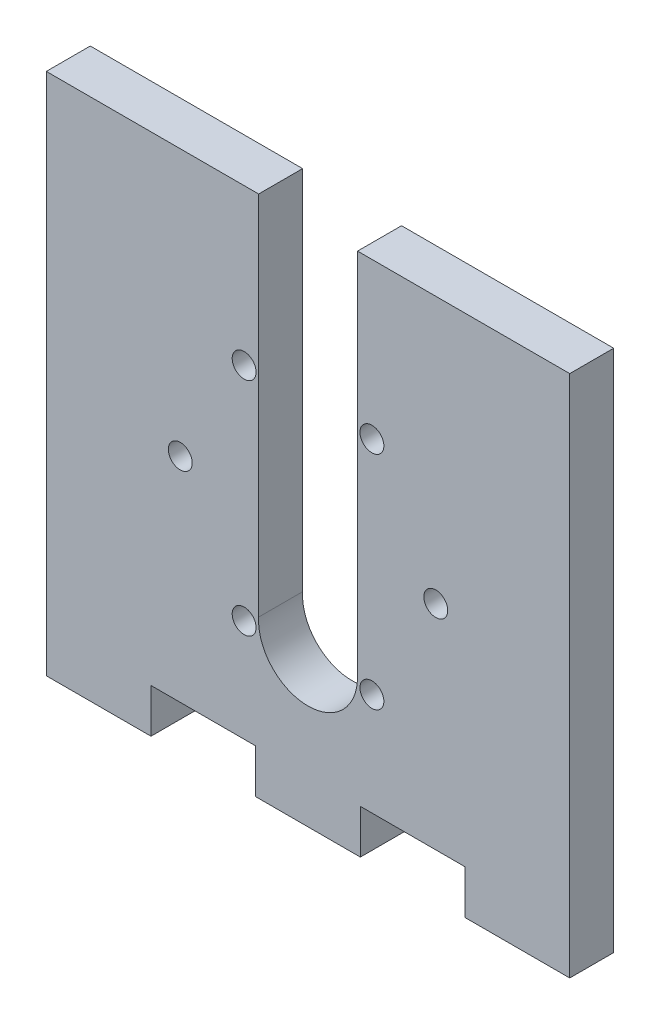
from build123d import *

# Parameters (mm, degrees)
SKETCH2_W           = 63.5
SKETCH2_H           = 63.5
BOSS_EXTRUDE1_DEPTH = 5.334
SKETCH4_W           = 12.7
SKETCH4_H           = 5.334
CUT_EXTRUDE1_DEPTH  = 5.334
SKETCH5_R           = 5.999999938
CUT_EXTRUDE2_DEPTH  = 5.334
SKETCH6_W           = 12
SKETCH6_H           = 44.450593975
CUT_EXTRUDE3_DEPTH  = 5.334
SKETCH7_R           = 1.45
CUT_EXTRUDE4_DEPTH  = 90.960833455


with BuildPart() as part:
    # Sketch2 → Boss-Extrude1 (new body)
    with BuildSketch(Plane.XY):
        with Locations((31.75, 31.75)):
            Rectangle(SKETCH2_W, SKETCH2_H)
    extrude(amount=BOSS_EXTRUDE1_DEPTH)

    # Sketch4 → Cut-Extrude1 (cut)
    with BuildSketch(Plane.XY.offset(5.334)):
        with Locations((19.05, 2.667)):
            Rectangle(SKETCH4_W, SKETCH4_H)
        with Locations((44.45, 2.667)):
            Rectangle(SKETCH4_W, SKETCH4_H)
    extrude(amount=-CUT_EXTRUDE1_DEPTH, mode=Mode.SUBTRACT)

    # Sketch5 → Cut-Extrude2 (cut)
    with BuildSketch(Plane.XY.offset(5.334)):
        with Locations((31.75, 18.699999938)):
            Circle(SKETCH5_R)
    extrude(amount=-CUT_EXTRUDE2_DEPTH, mode=Mode.SUBTRACT)

    # Sketch6 → Cut-Extrude3 (cut)
    with BuildSketch(Plane.XY.offset(5.334)):
        with Locations((31.76018242, 41.274703013)):
            Rectangle(SKETCH6_W, SKETCH6_H)
    extrude(amount=-CUT_EXTRUDE3_DEPTH, mode=Mode.SUBTRACT)

    # Sketch7 → Cut-Extrude4 (cut, through all)
    with BuildSketch(Plane.XY.offset(5.334)):
        with Locations((47.25, 31.199999957)):
            Circle(SKETCH7_R)
        with Locations((39.5, 17.776606198)):
            Circle(SKETCH7_R)
        with Locations((24, 17.776606198)):
            Circle(SKETCH7_R)
        with Locations((16.25, 31.199999957)):
            Circle(SKETCH7_R)
        with Locations((24, 44.623393716)):
            Circle(SKETCH7_R)
        with Locations((39.5, 44.623393716)):
            Circle(SKETCH7_R)
    extrude(amount=-CUT_EXTRUDE4_DEPTH, mode=Mode.SUBTRACT)


solid = part.part
